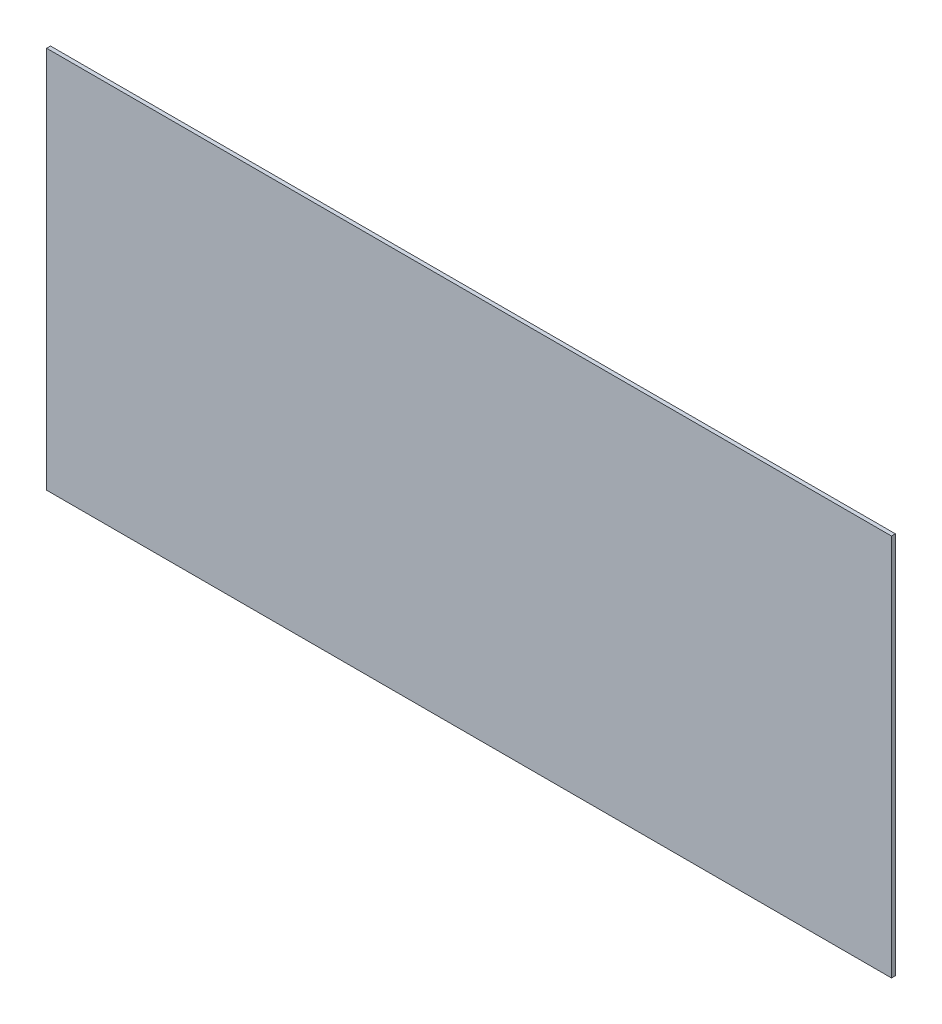
from build123d import *

# Parameters (mm, degrees)
SKETCH1_W           = 345.57
SKETCH1_H           = 156.55
BOSS_EXTRUDE1_DEPTH = 1.5875


with BuildPart() as part:
    # Sketch1 → Boss-Extrude1 (new body)
    with BuildSketch(Plane.XY):
        with Locations((172.785, 78.275)):
            Rectangle(SKETCH1_W, SKETCH1_H)
    extrude(amount=BOSS_EXTRUDE1_DEPTH)


solid = part.part
